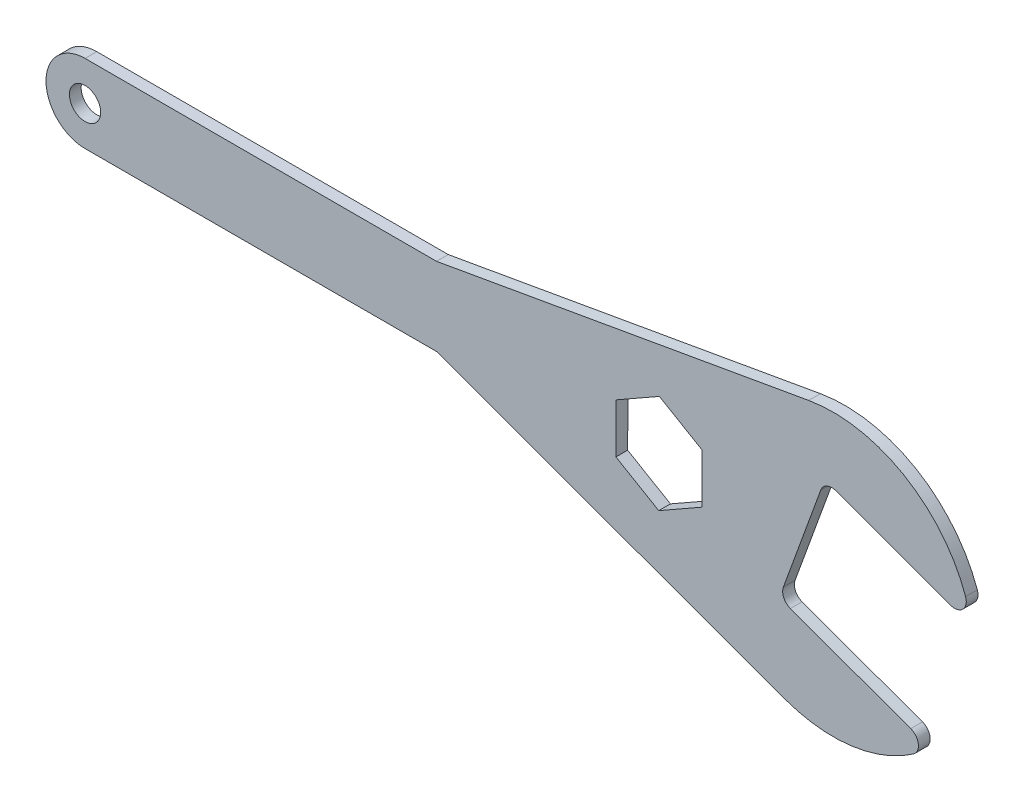
from build123d import *

# Parameters (mm, degrees)
BOSS_EXTRUDE1_DEPTH = 3
SKETCH4_R           = 4
CUT_EXTRUDE1_DEPTH  = 3
FILLET1_R           = 3
FILLET2_R           = 3
FILLET4_R           = 3
FILLET5_R           = 3


with BuildPart() as part:
    # Sketch3 → Boss-Extrude1 (new body)
    with BuildSketch(Plane.XY):
        with BuildLine():
            Line((90, 10), (0, 10))
            ThreePointArc((0, 10), (-10, 0), (0, -10))
            Line((0, -10), (89.999342556, -10))
            Line((89.999342556, -10), (179.234195732, -42.478830415))
            ThreePointArc((179.234195732, -42.478830415), (198.912530475, -43.888338079), (216.37877505, -34.714796202))
            Line((216.37877505, -34.714796202), (177.783610295, -20.667305045))
            Line((177.783610295, -20.667305045), (189.412295169, 11.282244062))
            Line((189.412295169, 11.282244062), (227, -2.398561671))
            ThreePointArc((227, -2.398561671), (212.1956726, 20.839577528), (185.295586496, 26.803183042))
            Line((185.295586496, 26.803183042), (90, 10))
        make_face()
    extrude(amount=BOSS_EXTRUDE1_DEPTH)

    # Sketch4 → Cut-Extrude1 (cut)
    with BuildSketch(Plane.XY.offset(3)):
        Circle(SKETCH4_R)
        Polygon((157.937239429, -10.553104382), (158.016476937, 2.148354383), (147.056309736, 8.56770546), (136.016905026, 2.285597773), (135.937667518, -10.415860992), (146.897834719, -16.835212069), align=None)
    extrude(amount=-CUT_EXTRUDE1_DEPTH, mode=Mode.SUBTRACT)

    # Fillet1
    fillet1_edges = [part.edges().sort_by_distance(p)[0] for p in [
        (177.783610295, -20.667305045, 1.5),
    ]]
    fillet(fillet1_edges, radius=FILLET1_R)

    # Fillet2
    fillet2_edges = [part.edges().sort_by_distance(p)[0] for p in [
        (189.412295169, 11.282244062, 1.5),
    ]]
    fillet(fillet2_edges, radius=FILLET2_R)

    # Fillet4
    fillet4_edges = [part.edges().sort_by_distance(p)[0] for p in [
        (227, -2.398561671, 1.5),
    ]]
    fillet(fillet4_edges, radius=FILLET4_R)

    # Fillet5
    fillet5_edges = [part.edges().sort_by_distance(p)[0] for p in [
        (216.37877505, -34.714796202, 1.5),
    ]]
    fillet(fillet5_edges, radius=FILLET5_R)


solid = part.part
